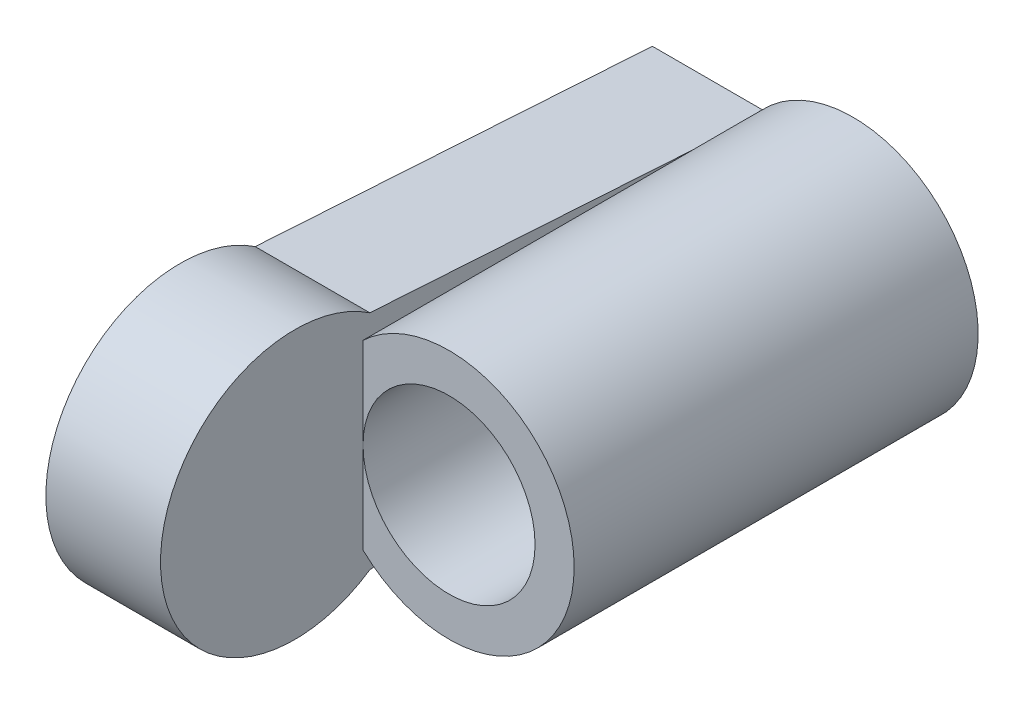
from build123d import *
from build123d.topology import SkipClean

# Parameters (mm, degrees)
BOSS_EXTRUDE1_DEPTH = 3
BOSS_EXTRUDE2_DEPTH = 1.4
SKETCH3_R           = 4.8
SKETCH3_R_2         = 3.3
BOSS_EXTRUDE3_DEPTH = 15.5
SKETCH4_R           = 3.3
SKETCH4_R_2         = 1.65
BOSS_EXTRUDE4_DEPTH = 1.5
CUT_EXTRUDE1_DEPTH  = 3


with BuildPart() as part:
    # Sketch1 → Boss-Extrude1 (new body)
    with BuildSketch(Plane(origin=(0, 0, 0), x_dir=(0, 0, -1), z_dir=(1, 0, 0))):
        with BuildLine():
            Line((2.880783046, 4.268909585), (12.721340672, 3.647013525))
            Line((12.721340672, 3.647013525), (18.118769618, 3.305910924))
            Line((18.118769618, 3.305910924), (18.118769618, -3.305910924))
            Line((18.118769618, -3.305910924), (12.721340672, -3.647013525))
            Line((12.721340672, -3.647013525), (2.880783046, -4.268909585))
            ThreePointArc((2.880783046, -4.268909585), (-5.15, 0), (2.880783046, 4.268909585))
        make_face()
        with BuildLine():
            Line((2.341473895, 2.8), (12.626733553, 2.15))
            Line((12.626733553, 2.15), (16.618769618, 1.897714348))
            Line((16.618769618, 1.897714348), (16.618769618, -1.897714348))
            Line((16.618769618, -1.897714348), (12.626733553, -2.15))
            Line((12.626733553, -2.15), (2.341473895, -2.8))
            ThreePointArc((2.341473895, -2.8), (-3.65, 0), (2.341473895, 2.8))
        make_face(mode=Mode.SUBTRACT)
    extrude(amount=BOSS_EXTRUDE1_DEPTH)

    # Sketch2 → Boss-Extrude2 (add)
    with SkipClean():  # the faces are left unmerged after this step: merging them gives an invalid solid
        with BuildSketch(Plane(origin=(3, 0, 0), x_dir=(0, 0, -1), z_dir=(1, 0, 0))):
            with BuildLine():
                Line((2.880783046, -4.268909585), (18.118769618, -3.305910924))
                Line((18.118769618, -3.305910924), (18.118769618, 3.305910924))
                Line((18.118769618, 3.305910924), (2.880783046, 4.268909585))
                ThreePointArc((2.880783046, 4.268909585), (-5.15, 0), (2.880783046, -4.268909585))
            make_face()
        extrude(amount=BOSS_EXTRUDE2_DEPTH)

    # Sketch3 → Boss-Extrude3 (add)
    with SkipClean():  # the faces are left unmerged after this step: merging them gives an invalid solid
        with BuildSketch(Plane(origin=(0, 0, -18.118769618), x_dir=(-1, 0, 0), z_dir=(0, 0, -1))):
            with Locations((-7.7, 0)):
                Circle(SKETCH3_R)
            with Locations((-7.7, 0)):
                Circle(SKETCH3_R_2, mode=Mode.SUBTRACT)
        extrude(amount=-BOSS_EXTRUDE3_DEPTH)

    # Sketch4 → Boss-Extrude4 (add)
    with SkipClean():  # the faces are left unmerged after this step: merging them gives an invalid solid
        with BuildSketch(Plane(origin=(0, 0, -18.118769618), x_dir=(-1, 0, 0), z_dir=(0, 0, -1))):
            with Locations((-7.7, 0)):
                Circle(SKETCH4_R)
            with Locations((-7.7, 0)):
                Circle(SKETCH4_R_2, mode=Mode.SUBTRACT)
        extrude(amount=-BOSS_EXTRUDE4_DEPTH)

    # Sketch5 → Cut-Extrude1 (cut)
    with SkipClean():  # the faces are left unmerged after this step: merging them gives an invalid solid
        with BuildSketch(Plane.ZY):
            with BuildLine():
                Line((-16.618769618, 1.897714348), (-2.341473895, 2.8))
                ThreePointArc((-2.341473895, 2.8), (3.65, 0), (-2.341473895, -2.8))
                Line((-2.341473895, -2.8), (-16.618769618, -1.897714348))
                Line((-16.618769618, -1.897714348), (-16.618769618, 1.897714348))
            make_face()
        extrude(amount=-CUT_EXTRUDE1_DEPTH, mode=Mode.SUBTRACT)


solid = part.part
